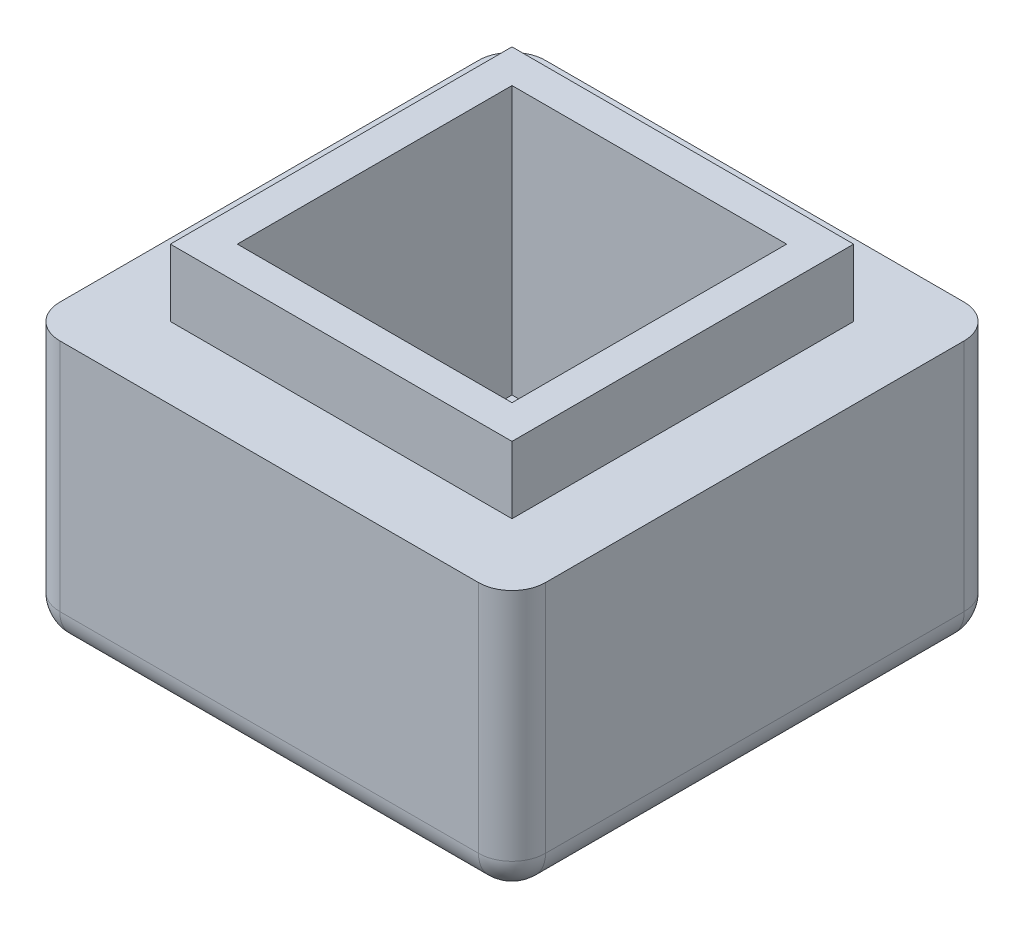
from build123d import *

# Parameters (mm, degrees)
SKETCH1_W           = 7.25
SKETCH1_H           = 7.25
BOSS_EXTRUDE1_DEPTH = 4
SKETCH3_W           = 5.1
SKETCH3_H           = 5.1
BOSS_EXTRUDE2_DEPTH = 1
SKETCH4_W           = 4.1
SKETCH4_H           = 4.1
CUT_EXTRUDE2_DEPTH  = 4
FILLET1_R           = 0.5


with BuildPart() as part:
    # Sketch1 → Boss-Extrude1 (new body)
    with BuildSketch(Plane(origin=(0, 0, 0), x_dir=(1, 0, 0), z_dir=(0, 1, 0))):
        Rectangle(SKETCH1_W, SKETCH1_H)
    extrude(amount=BOSS_EXTRUDE1_DEPTH)

    # Sketch3 → Boss-Extrude2 (add)
    with BuildSketch(Plane(origin=(0, 4, 0), x_dir=(1, 0, 0), z_dir=(0, 1, 0))):
        Rectangle(SKETCH3_W, SKETCH3_H)
    extrude(amount=BOSS_EXTRUDE2_DEPTH)

    # Sketch4 → Cut-Extrude2 (cut)
    with BuildSketch(Plane(origin=(0, 5, 0), x_dir=(1, 0, 0), z_dir=(0, 1, 0))):
        Rectangle(SKETCH4_W, SKETCH4_H)
    extrude(amount=-CUT_EXTRUDE2_DEPTH, mode=Mode.SUBTRACT)

    # Fillet1
    fillet1_edges = [part.edges().sort_by_distance(p)[0] for p in [
        (0, 0, 3.625),
        (-3.625, 0, 0),
        (0, 0, -3.625),
        (3.625, 0, 0),
        (3.625, 2, 3.625),
        (-3.625, 2, 3.625),
        (-3.625, 2, -3.625),
        (3.625, 2, -3.625),
    ]]
    fillet(fillet1_edges, radius=FILLET1_R)


solid = part.part
